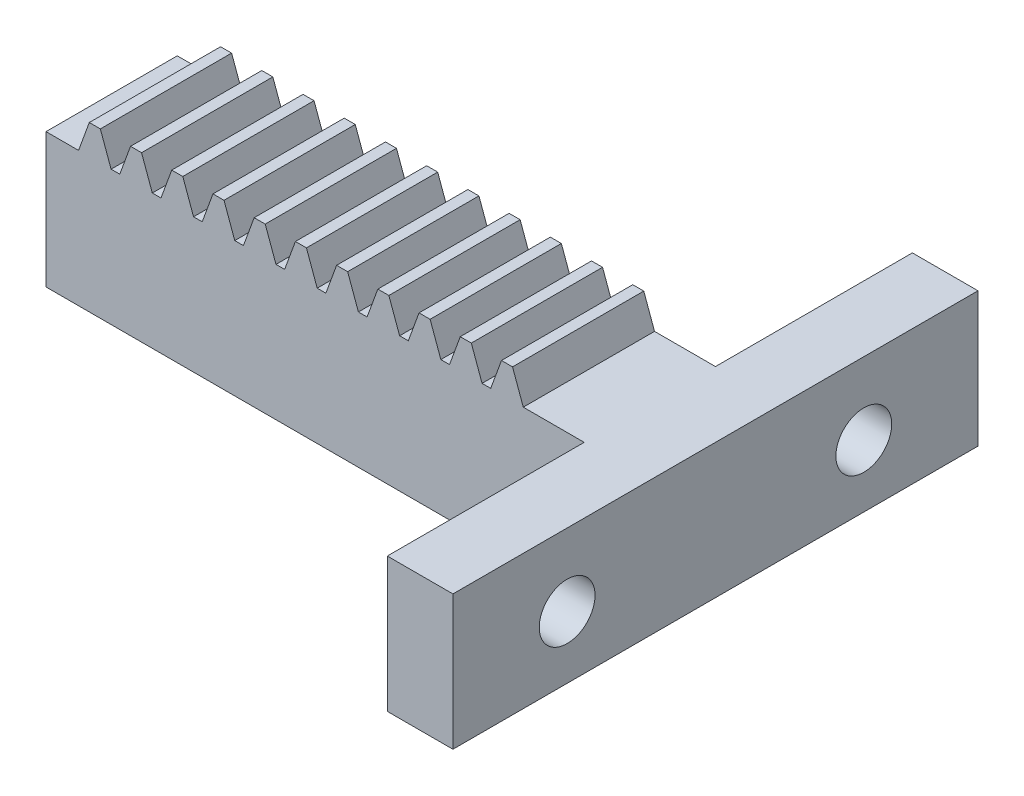
from build123d import *

# Parameters (mm, degrees)
SKETCH_1_W             = 92
SKETCH_1_H             = 20
EXTRUDE_1_DEPTH        = 20
CUT_EXTRUDE_1_DEPTH    = 97.249675324
PATTERN_LINEAR_1_COUNT = 14
PATTERN_LINEAR_1_PITCH = 6.28
CUT_EXTRUDE_2_DEPTH    = 97.249675324
SKETCH_4_W             = 30
SKETCH_4_H             = 15.5
EXTRUDE_2_DEPTH        = 10
EXTRUDE_3_DEPTH        = 5
SKETCH_9_R             = 4.25
CUT_EXTRUDE_6_DEPTH    = 107.60206377
SKETCH_11_W            = 20
SKETCH_11_H            = 5
EXTRUDE_4_DEPTH        = 82
SKETCH_12_R            = 1.75
CUT_EXTRUDE_7_DEPTH    = 3


with BuildPart() as part:
    # 草图1 → 凸台-拉伸1 (new body)
    with BuildSketch(Plane.XY):
        with Locations((46, 10)):
            Rectangle(SKETCH_1_W, SKETCH_1_H)
    extrude(amount=EXTRUDE_1_DEPTH)

    # 草图2 → 切除-拉伸1 (cut, through all)
    with BuildSketch(Plane.XY.offset(20)):
        Polygon((2, 20), (3.637866054, 15.5), (4.959614883, 15.5), (6.597480937, 20), align=None)
    cut_extrude_1 = extrude(amount=-CUT_EXTRUDE_1_DEPTH, mode=Mode.SUBTRACT)

    # 阵列(线性)1: 切除-拉伸1 ×14
    with Locations(*[(i * PATTERN_LINEAR_1_PITCH, 0, 0) for i in range(1, PATTERN_LINEAR_1_COUNT)]):
        add(cut_extrude_1, mode=Mode.SUBTRACT)

    # 草图3 → 切除-拉伸2 (cut, through all)
    with BuildSketch(Plane.XY.offset(20)):
        Polygon((2, 20), (0, 20), (0, 15.5), (3.637866054, 15.5), align=None)
        Polygon((74.039614883, 15.5), (75.677480937, 20), (92, 20), (92, 15.5), align=None)
    extrude(amount=-CUT_EXTRUDE_2_DEPTH, mode=Mode.SUBTRACT)

    # 草图4 → 凸台-拉伸2 (add)
    with BuildSketch(Plane(origin=(92, 0, 0), x_dir=(0, 0, -1), z_dir=(1, 0, 0))):
        with Locations((-35, 7.75)):
            Rectangle(SKETCH_4_W, SKETCH_4_H)
        with Locations((15, 7.75)):
            Rectangle(SKETCH_4_W, SKETCH_4_H)
    extrude(amount=-EXTRUDE_2_DEPTH)

    # 草图6 → 凸台-拉伸3 (add)
    with BuildSketch(Plane.XZ):
        Polygon((82, 0), (82, 20), (82, 50), (92, 50), (92, -30), (82, -30), align=None)
    extrude(amount=EXTRUDE_3_DEPTH)

    # 草图9 → 切除-拉伸6 (cut, through all)
    with BuildSketch(Plane(origin=(92, 0, 0), x_dir=(0, 0, -1), z_dir=(1, 0, 0))):
        with Locations((-32.6, 4.5)):
            Circle(SKETCH_9_R)
        with Locations(Location((12.6, 4.5, 0), (0, 0, 180))):
            Circle(SKETCH_9_R)
    extrude(amount=-CUT_EXTRUDE_6_DEPTH, mode=Mode.SUBTRACT)

    # 草图11 → 凸台-拉伸4 (add)
    with BuildSketch(Plane.ZY):
        with Locations((10, -2.5)):
            Rectangle(SKETCH_11_W, SKETCH_11_H)
    extrude(amount=-EXTRUDE_4_DEPTH)

    # 草图12 → 切除-拉伸7 (cut)
    with BuildSketch(Plane.XZ.offset(5)):
        with Locations(Location((7.5, 10, 0), (0, 0, 270))):
            Circle(SKETCH_12_R)
        with Locations(Location((27.5, 10, 0), (0, 0, 270))):
            Circle(SKETCH_12_R)
        with Locations(Location((47.5, 10, 0), (0, 0, 270))):
            Circle(SKETCH_12_R)
    extrude(amount=-CUT_EXTRUDE_7_DEPTH, mode=Mode.SUBTRACT)


solid = part.part
